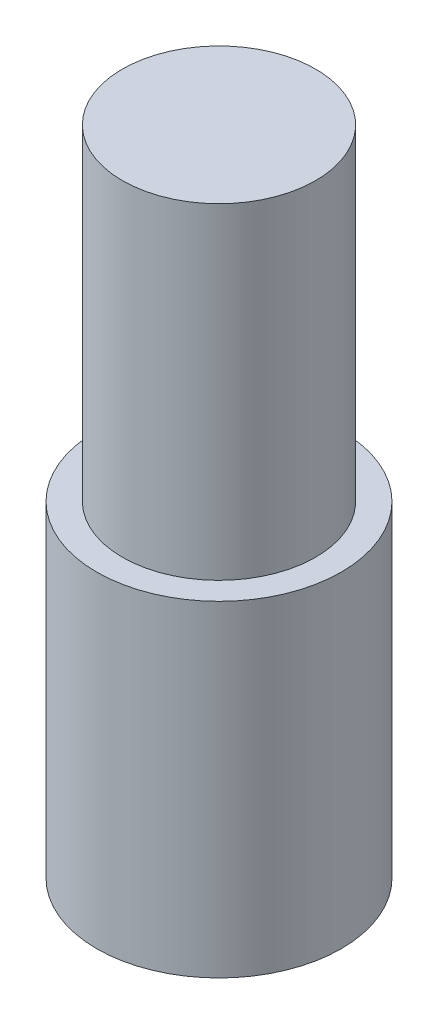
from build123d import *

# Parameters (mm, degrees)
SKETCH1_R           = 4.7625
BOSS_EXTRUDE1_DEPTH = 25.4
SKETCH2_R           = 5.726240141
SKETCH2_R_2         = 3.7625
CUT_EXTRUDE1_DEPTH  = 12.7


with BuildPart() as part:
    # Sketch1 → Boss-Extrude1 (new body)
    with BuildSketch(Plane(origin=(0, 0, 0), x_dir=(1, 0, 0), z_dir=(0, 1, 0))):
        with Locations(Location((0, 0, 0), (0, 0, 270))):
            Circle(SKETCH1_R)
    extrude(amount=BOSS_EXTRUDE1_DEPTH)

    # Sketch2 → Cut-Extrude1 (cut)
    with BuildSketch(Plane(origin=(0, 25.4, 0), x_dir=(1, 0, 0), z_dir=(0, 1, 0))):
        Circle(SKETCH2_R)
        with Locations(Location((0, 0, 0), (0, 0, 270))):
            Circle(SKETCH2_R_2, mode=Mode.SUBTRACT)
    extrude(amount=-CUT_EXTRUDE1_DEPTH, mode=Mode.SUBTRACT)


solid = part.part
